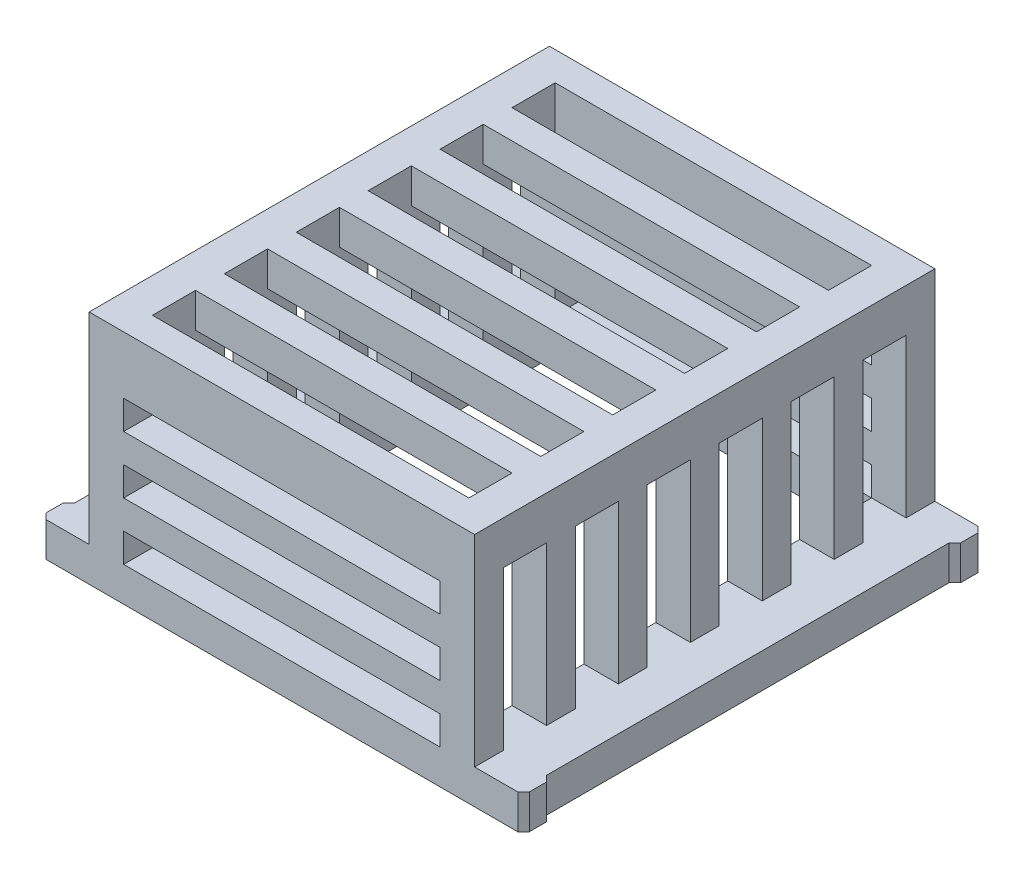
from build123d import *

# Parameters (mm, degrees)
BOSS_EXTRUDE1_DEPTH = 32
SKETCH2_W           = 22
SKETCH2_H           = 2
BOSS_EXTRUDE2_DEPTH = 14
SKETCH4_W           = 3
SKETCH4_H           = 11
CUT_EXTRUDE2_DEPTH  = 45.506992773
LPATTERN1_COUNT     = 6
LPATTERN1_PITCH     = 5
SKETCH5_W           = 22
SKETCH5_H           = 3
CUT_EXTRUDE3_DEPTH  = 40.853893963
LPATTERN2_COUNT     = 6
LPATTERN2_PITCH     = 5
SKETCH6_W           = 22
SKETCH6_H           = 2
CUT_EXTRUDE4_DEPTH  = 37.567270471
LPATTERN3_COUNT     = 3
LPATTERN3_PITCH     = 4
BOSS_EXTRUDE3_DEPTH = 2.4


with BuildPart() as part:
    # Sketch1 → Boss-Extrude1 (new body)
    with BuildSketch(Plane.XY):
        Polygon((-13.608, -5.703470261), (-13.608, -8.103470261), (-8.208, -8.103470261), (-8.208, 5.896529739), (13.792, 5.896529739), (13.792, -8.103470261), (19.192, -8.103470261), (19.192, -5.703470261), (16.192, -5.703470261), (16.192, 8.296529739), (-10.608, 8.296529739), (-10.608, -5.703470261), align=None)
    extrude(amount=BOSS_EXTRUDE1_DEPTH)

    # Sketch2 → Boss-Extrude2 (add)
    with BuildSketch(Plane.XZ.offset(-5.896529739)):
        with Locations((2.792, 31)):
            Rectangle(SKETCH2_W, SKETCH2_H)
        with Locations((2.792, 1)):
            Rectangle(SKETCH2_W, SKETCH2_H)
    extrude(amount=BOSS_EXTRUDE2_DEPTH)

    # Sketch4 → Cut-Extrude2 (cut, through all)
    with BuildSketch(Plane.ZY.offset(10.608)):
        with Locations((28.5, -0.203470261)):
            Rectangle(SKETCH4_W, SKETCH4_H)
    cut_extrude2 = extrude(amount=-CUT_EXTRUDE2_DEPTH, mode=Mode.SUBTRACT)

    # LPattern1: Cut-Extrude2 ×6
    with Locations(*[(0, 0, -i * LPATTERN1_PITCH) for i in range(1, LPATTERN1_COUNT)]):
        add(cut_extrude2, mode=Mode.SUBTRACT)

    # Sketch5 → Cut-Extrude3 (cut, through all)
    with BuildSketch(Plane.XZ.offset(-5.896529739)):
        with Locations((2.792, 28.5)):
            Rectangle(SKETCH5_W, SKETCH5_H)
    cut_extrude3 = extrude(amount=-CUT_EXTRUDE3_DEPTH, mode=Mode.SUBTRACT)

    # LPattern2: Cut-Extrude3 ×6
    with Locations(*[(0, 0, -i * LPATTERN2_PITCH) for i in range(1, LPATTERN2_COUNT)]):
        add(cut_extrude3, mode=Mode.SUBTRACT)

    # Sketch6 → Cut-Extrude4 (cut, symmetric)
    with BuildSketch(Plane(origin=(0, 0, 30), x_dir=(-1, 0, 0), z_dir=(0, 0, -1))):
        with Locations((-2.792, -4.703470261)):
            Rectangle(SKETCH6_W, SKETCH6_H)
    cut_extrude4 = extrude(amount=CUT_EXTRUDE4_DEPTH, both=True, mode=Mode.SUBTRACT)

    # LPattern3: Cut-Extrude4 ×3
    with Locations(*[(0, i * LPATTERN3_PITCH, 0) for i in range(1, LPATTERN3_COUNT)]):
        add(cut_extrude4, mode=Mode.SUBTRACT)

    # Sketch8 → Boss-Extrude3 (add)
    with BuildSketch(Plane.XZ.offset(8.103470261)):
        Polygon((-13.608, 30), (-14.008, 30.4), (-14.008, 31.6), (-13.608, 32), align=None)
        Polygon((-13.608, 2), (-13.608, 0), (-14.008, 0.4), (-14.008, 1.6), align=None)
        Polygon((19.192, 2), (19.592, 1.6), (19.592, 0.4), (19.192, 0), align=None)
        Polygon((19.192, 30), (19.192, 32), (19.592, 31.6), (19.592, 30.4), align=None)
    extrude(amount=-BOSS_EXTRUDE3_DEPTH)


solid = part.part
